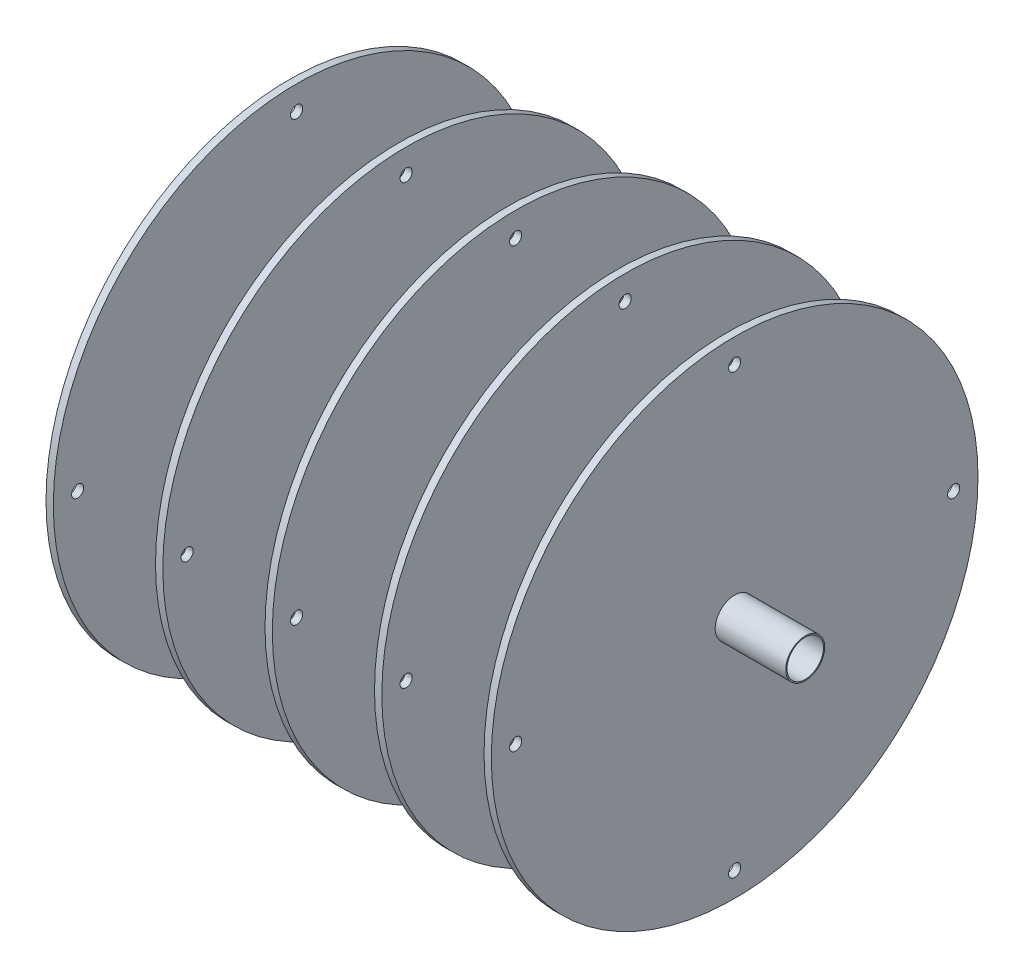
from build123d import *

# Parameters (mm, degrees)
SKETCH1_R                  = 8
SKETCH1_R_2                = 7.5
BOSS_EXTRUDE1_DEPTH        = 121.5
SKETCH2_R                  = 100
BOSS_EXTRUDE2_DEPTH        = 3
SKETCH3_R                  = 2.5
CUT_EXTRUDE1_DEPTH         = 257.507309837
CIRPATTERN1_COUNT          = 4
LPATTERN1_COUNT            = 5
LPATTERN1_PITCH            = 45
LPATTERN1_COPY_1_SKETCH_R  = 2.5
LPATTERN1_COPY_1_DEPTH     = 257.507309837
LPATTERN1_COPY_2_SKETCH_R  = 2.5
LPATTERN1_COPY_2_DEPTH     = 257.507309837
LPATTERN1_COPY_3_SKETCH_R  = 2.5
LPATTERN1_COPY_3_DEPTH     = 257.507309837
LPATTERN1_COPY_4_SKETCH_R  = 2.5
LPATTERN1_COPY_4_DEPTH     = 257.507309837
LPATTERN1_COPY_5_SKETCH_R  = 2.5
LPATTERN1_COPY_5_DEPTH     = 257.507309837
LPATTERN1_COPY_6_SKETCH_R  = 2.5
LPATTERN1_COPY_6_DEPTH     = 257.507309837
LPATTERN1_COPY_7_SKETCH_R  = 2.5
LPATTERN1_COPY_7_DEPTH     = 257.507309837
LPATTERN1_COPY_8_SKETCH_R  = 2.5
LPATTERN1_COPY_8_DEPTH     = 257.507309837
LPATTERN1_COPY_9_SKETCH_R  = 2.5
LPATTERN1_COPY_9_DEPTH     = 257.507309837
LPATTERN1_COPY_10_SKETCH_R = 2.5
LPATTERN1_COPY_10_DEPTH    = 257.507309837
LPATTERN1_COPY_11_SKETCH_R = 2.5
LPATTERN1_COPY_11_DEPTH    = 257.507309837
LPATTERN1_COPY_12_SKETCH_R = 2.5
LPATTERN1_COPY_12_DEPTH    = 257.507309837


with BuildPart() as part:
    # Sketch1 → Boss-Extrude1 (new, symmetric)
    with BuildSketch(Plane(origin=(0, 0, 0), x_dir=(0, 0, -1), z_dir=(1, 0, 0))):
        Circle(SKETCH1_R)
        Circle(SKETCH1_R_2, mode=Mode.SUBTRACT)
    extrude(amount=BOSS_EXTRUDE1_DEPTH, both=True)

    # Sketch2 → Boss-Extrude2 (add)
    with BuildSketch(Plane(origin=(92.5, 0, 0), x_dir=(0, 0, -1), z_dir=(1, 0, 0))):
        Circle(SKETCH2_R)
    boss_extrude2 = extrude(amount=-BOSS_EXTRUDE2_DEPTH)

    # Sketch3 → Cut-Extrude1 (cut, through all)
    with BuildSketch(Plane(origin=(92.5, 0, 0), x_dir=(0, 0, -1), z_dir=(1, 0, 0))):
        with Locations((0, 90)):
            Circle(SKETCH3_R)
    cut_extrude1 = extrude(amount=-CUT_EXTRUDE1_DEPTH, mode=Mode.SUBTRACT)

    # CirPattern1: Cut-Extrude1 ×4 about axis
    cirpattern1_axis = Axis((0, 0, 0), (1, 0, 0))
    for i in range(1, CIRPATTERN1_COUNT):
        add(cut_extrude1.rotate(cirpattern1_axis, i * 360 / CIRPATTERN1_COUNT), mode=Mode.SUBTRACT)

    # LPattern1: Boss-Extrude2, Cut-Extrude1 ×5
    with Locations(*[(-i * LPATTERN1_PITCH, 0, 0) for i in range(1, LPATTERN1_COUNT)]):
        add(boss_extrude2)
        add(cut_extrude1, mode=Mode.SUBTRACT)

    # LPattern1 copy 1 sketch → LPattern1 copy 1 (cut, through all)
    with BuildSketch(Plane.YZ.offset(47.5)):
        with Locations((0, 90)):
            Circle(LPATTERN1_COPY_1_SKETCH_R)
    extrude(amount=-LPATTERN1_COPY_1_DEPTH, mode=Mode.SUBTRACT)

    # LPattern1 copy 2 sketch → LPattern1 copy 2 (cut, through all)
    with BuildSketch(Plane.YZ.offset(2.5)):
        with Locations((0, 90)):
            Circle(LPATTERN1_COPY_2_SKETCH_R)
    extrude(amount=-LPATTERN1_COPY_2_DEPTH, mode=Mode.SUBTRACT)

    # LPattern1 copy 3 sketch → LPattern1 copy 3 (cut, through all)
    with BuildSketch(Plane.YZ.offset(-42.5)):
        with Locations((0, 90)):
            Circle(LPATTERN1_COPY_3_SKETCH_R)
    extrude(amount=-LPATTERN1_COPY_3_DEPTH, mode=Mode.SUBTRACT)

    # LPattern1 copy 4 sketch → LPattern1 copy 4 (cut, through all)
    with BuildSketch(Plane.YZ.offset(-87.5)):
        with Locations((0, 90)):
            Circle(LPATTERN1_COPY_4_SKETCH_R)
    extrude(amount=-LPATTERN1_COPY_4_DEPTH, mode=Mode.SUBTRACT)

    # LPattern1 copy 5 sketch → LPattern1 copy 5 (cut, through all)
    with BuildSketch(Plane(origin=(47.5, 0, 0), x_dir=(0, 0, 1), z_dir=(1, 0, 0))):
        with Locations((0, 90)):
            Circle(LPATTERN1_COPY_5_SKETCH_R)
    extrude(amount=-LPATTERN1_COPY_5_DEPTH, mode=Mode.SUBTRACT)

    # LPattern1 copy 6 sketch → LPattern1 copy 6 (cut, through all)
    with BuildSketch(Plane(origin=(2.5, 0, 0), x_dir=(0, 0, 1), z_dir=(1, 0, 0))):
        with Locations((0, 90)):
            Circle(LPATTERN1_COPY_6_SKETCH_R)
    extrude(amount=-LPATTERN1_COPY_6_DEPTH, mode=Mode.SUBTRACT)

    # LPattern1 copy 7 sketch → LPattern1 copy 7 (cut, through all)
    with BuildSketch(Plane(origin=(-42.5, 0, 0), x_dir=(0, 0, 1), z_dir=(1, 0, 0))):
        with Locations((0, 90)):
            Circle(LPATTERN1_COPY_7_SKETCH_R)
    extrude(amount=-LPATTERN1_COPY_7_DEPTH, mode=Mode.SUBTRACT)

    # LPattern1 copy 8 sketch → LPattern1 copy 8 (cut, through all)
    with BuildSketch(Plane(origin=(-87.5, 0, 0), x_dir=(0, 0, 1), z_dir=(1, 0, 0))):
        with Locations((0, 90)):
            Circle(LPATTERN1_COPY_8_SKETCH_R)
    extrude(amount=-LPATTERN1_COPY_8_DEPTH, mode=Mode.SUBTRACT)

    # LPattern1 copy 9 sketch → LPattern1 copy 9 (cut, through all)
    with BuildSketch(Plane(origin=(47.5, 0, 0), x_dir=(0, -1, 0), z_dir=(1, 0, 0))):
        with Locations((0, 90)):
            Circle(LPATTERN1_COPY_9_SKETCH_R)
    extrude(amount=-LPATTERN1_COPY_9_DEPTH, mode=Mode.SUBTRACT)

    # LPattern1 copy 10 sketch → LPattern1 copy 10 (cut, through all)
    with BuildSketch(Plane(origin=(2.5, 0, 0), x_dir=(0, -1, 0), z_dir=(1, 0, 0))):
        with Locations((0, 90)):
            Circle(LPATTERN1_COPY_10_SKETCH_R)
    extrude(amount=-LPATTERN1_COPY_10_DEPTH, mode=Mode.SUBTRACT)

    # LPattern1 copy 11 sketch → LPattern1 copy 11 (cut, through all)
    with BuildSketch(Plane(origin=(-42.5, 0, 0), x_dir=(0, -1, 0), z_dir=(1, 0, 0))):
        with Locations((0, 90)):
            Circle(LPATTERN1_COPY_11_SKETCH_R)
    extrude(amount=-LPATTERN1_COPY_11_DEPTH, mode=Mode.SUBTRACT)

    # LPattern1 copy 12 sketch → LPattern1 copy 12 (cut, through all)
    with BuildSketch(Plane(origin=(-87.5, 0, 0), x_dir=(0, -1, 0), z_dir=(1, 0, 0))):
        with Locations((0, 90)):
            Circle(LPATTERN1_COPY_12_SKETCH_R)
    extrude(amount=-LPATTERN1_COPY_12_DEPTH, mode=Mode.SUBTRACT)


solid = part.part
